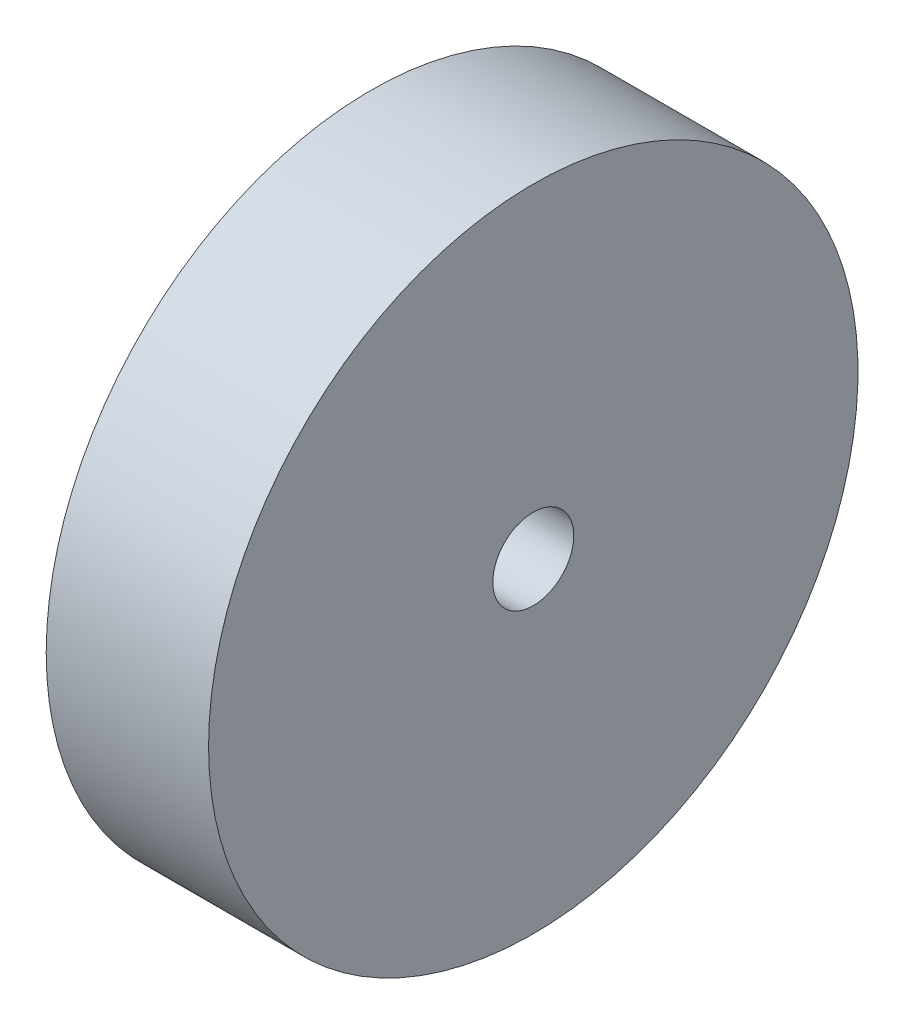
from build123d import *

# Parameters (mm, degrees)
SKETCH1_R           = 152.4
BOSS_EXTRUDE1_DEPTH = 76.2
SKETCH2_R           = 18.999962
CUT_EXTRUDE1_DEPTH  = 229.6


with BuildPart() as part:
    # Sketch1 → Boss-Extrude1 (new body)
    with BuildSketch(Plane(origin=(0, 0, 0), x_dir=(0, 0, -1), z_dir=(1, 0, 0))):
        with Locations(Location((0, 0, 0), (0, 0, 180))):
            Circle(SKETCH1_R)
    extrude(amount=BOSS_EXTRUDE1_DEPTH)

    # Sketch2 → Cut-Extrude1 (cut, through all)
    with BuildSketch(Plane(origin=(76.2, 0, 0), x_dir=(0, 0, -1), z_dir=(1, 0, 0))):
        Circle(SKETCH2_R)
    extrude(amount=-CUT_EXTRUDE1_DEPTH, mode=Mode.SUBTRACT)


solid = part.part
